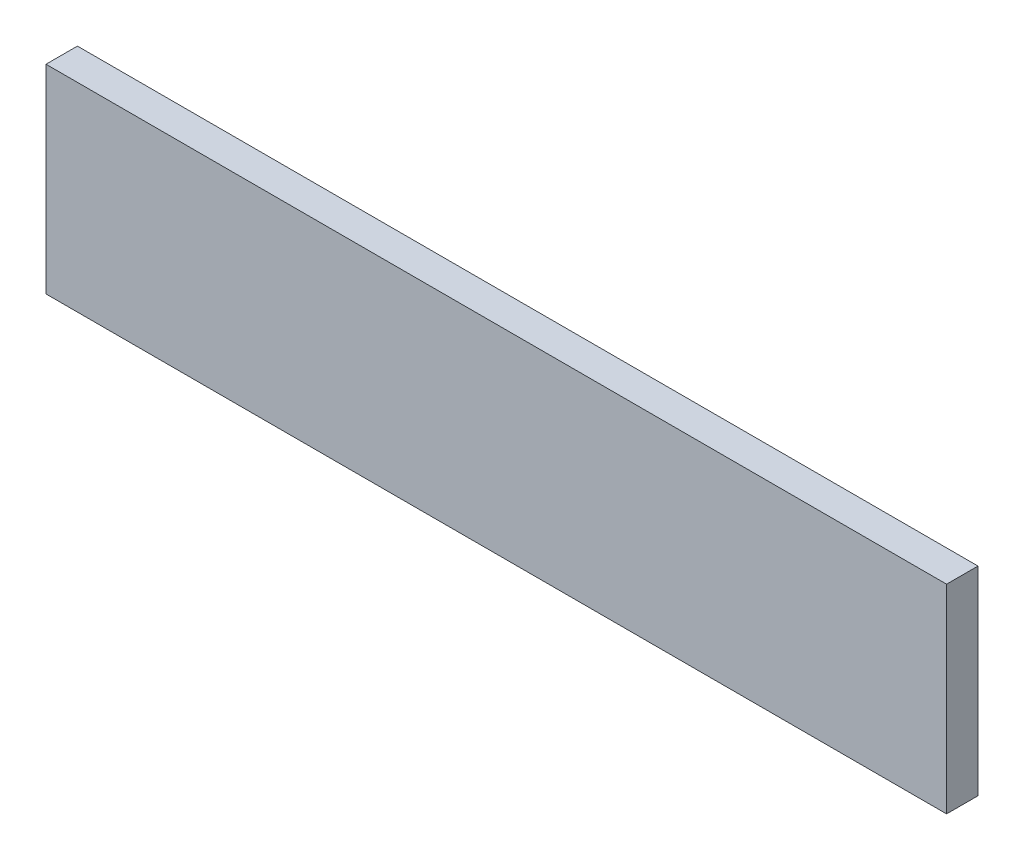
from build123d import *

# Parameters (mm, degrees)
ESQUISSE2_W        = 430
ESQUISSE2_H        = 95
BOSS_EXTRU_1_DEPTH = 15


with BuildPart() as part:
    # Esquisse2 → Boss.-Extru.1 (new body)
    with BuildSketch(Plane.XY):
        Rectangle(ESQUISSE2_W, ESQUISSE2_H)
    extrude(amount=BOSS_EXTRU_1_DEPTH)


solid = part.part
